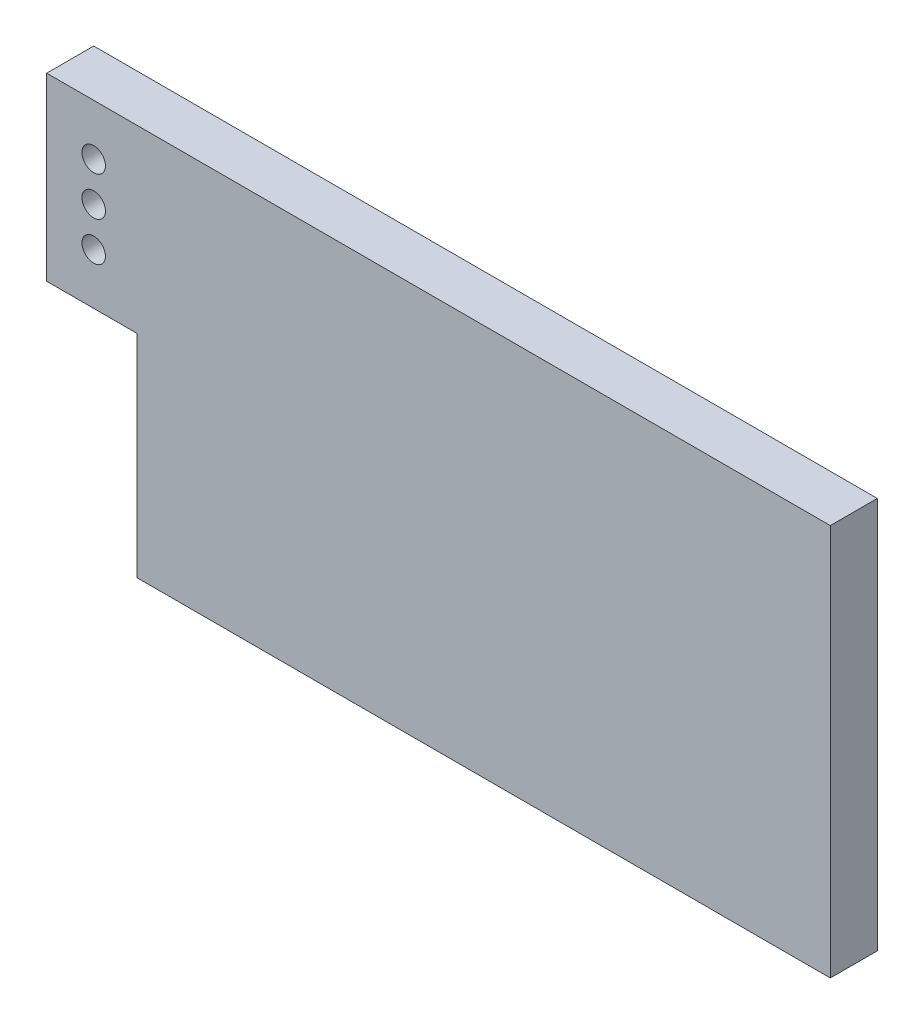
from build123d import *

# Parameters (mm, degrees)
SKETCH1_W           = 10
SKETCH1_H           = 5
BOSS_EXTRUDE1_DEPTH = 0.6
SKETCH2_W           = 1.15
SKETCH2_H           = 2.7
CUT_EXTRUDE1_DEPTH  = 6.622277119
SKETCH3_R           = 0.15
CUT_EXTRUDE2_DEPTH  = 6.622277119


with BuildPart() as part:
    # Sketch1 → Boss-Extrude1 (new body)
    with BuildSketch(Plane.XY):
        Rectangle(SKETCH1_W, SKETCH1_H)
    extrude(amount=BOSS_EXTRUDE1_DEPTH)

    # Sketch2 → Cut-Extrude1 (cut, through all)
    with BuildSketch(Plane.XY.offset(0.6)):
        with Locations((-4.425, -1.15)):
            Rectangle(SKETCH2_W, SKETCH2_H)
    extrude(amount=-CUT_EXTRUDE1_DEPTH, mode=Mode.SUBTRACT)

    # Sketch3 → Cut-Extrude2 (cut, through all)
    with BuildSketch(Plane.XY.offset(0.6)):
        with Locations((-4.4, 1.85)):
            Circle(SKETCH3_R)
        with Locations((-4.4, 1.35)):
            Circle(SKETCH3_R)
        with Locations((-4.4, 0.85)):
            Circle(SKETCH3_R)
    extrude(amount=-CUT_EXTRUDE2_DEPTH, mode=Mode.SUBTRACT)


solid = part.part
